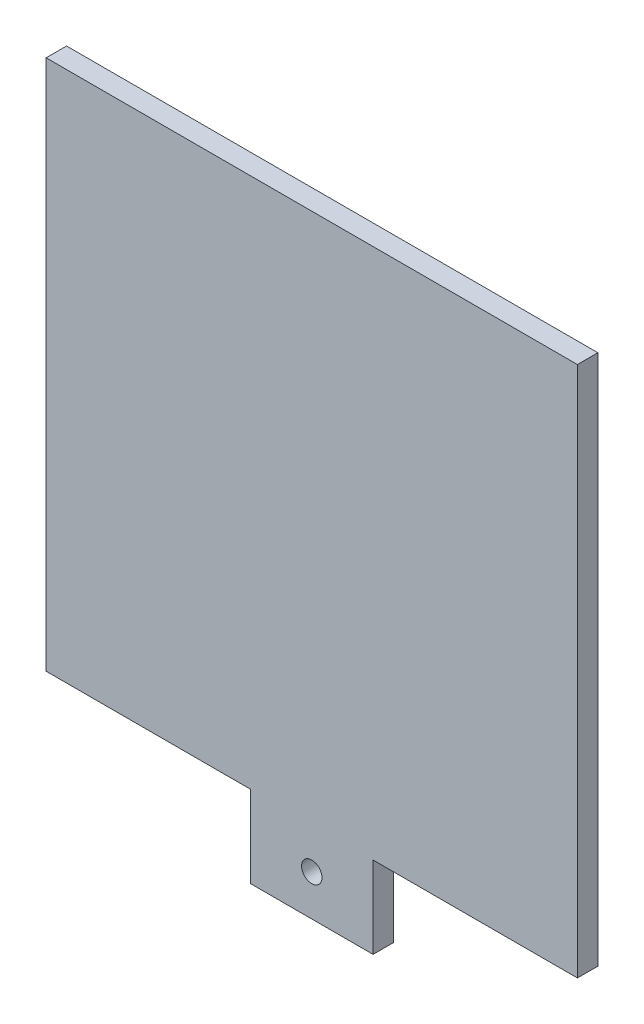
from build123d import *

# Parameters (mm, degrees)
P_IDAT_VYSUNUT_M1_DEPTH  = 5
SKICA2_R                 = 2.5
ODEBRAT_VYSUNUT_M1_DEPTH = 5


with BuildPart() as part:
    # Skica1 → Přidat vysunutím1 (new body)
    with BuildSketch(Plane.XY):
        Polygon((-15, -85), (-15, -65), (-65, -65), (-65, 65), (65, 65), (65, -65), (15, -65), (15, -85), align=None)
    extrude(amount=P_IDAT_VYSUNUT_M1_DEPTH)

    # Skica2 → Odebrat vysunutím1 (cut)
    with BuildSketch(Plane(origin=(0, 0, 0), x_dir=(-1, 0, 0), z_dir=(0, 0, -1))):
        with Locations((0, -75)):
            Circle(SKICA2_R)
    extrude(amount=-ODEBRAT_VYSUNUT_M1_DEPTH, mode=Mode.SUBTRACT)


solid = part.part
